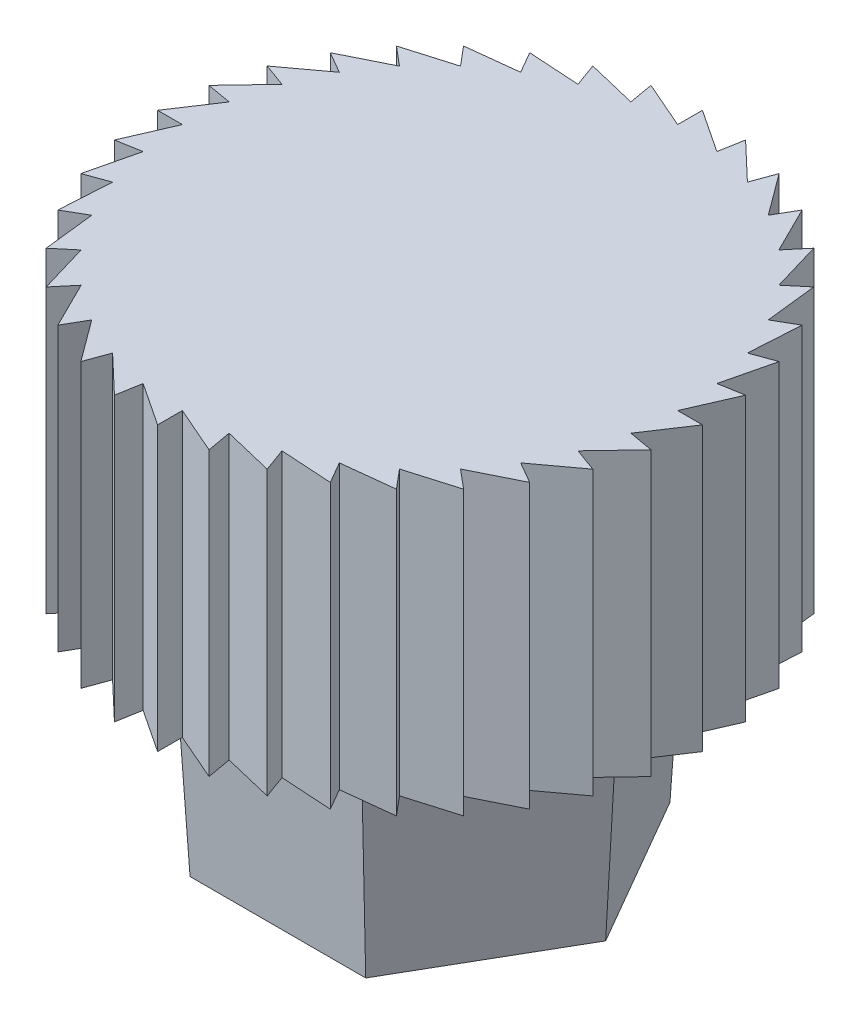
from build123d import *

# Parameters (mm, degrees)
BOSS_EXTRUDE1_DEPTH = 4


with BuildPart() as part:
    # Sketch1 → Loft1 section 0
    with BuildSketch(Plane(origin=(0, 0, 0), x_dir=(1, 0, 0), z_dir=(0, 1, 0))):
        with BuildLine():
            Line((2.482606158, 0), (1.241303079, 2.15))
            Line((1.241303079, 2.15), (-1.241303079, 2.15))
            Line((-1.241303079, 2.15), (-2.482606158, 0))
            Line((-2.482606158, 0), (-1.241303079, -2.15))
            Line((-1.241303079, -2.15), (1.241303079, -2.15))
            Line((1.241303079, -2.15), (2.482606158, 0))
        make_face()
    # Sketch2 → Loft1 section 1
    with BuildSketch(Plane(origin=(0, 3, 0), x_dir=(1, 0, 0), z_dir=(0, 1, 0))):
        with BuildLine():
            Line((2.655811238, 0), (1.327905619, 2.3))
            Line((1.327905619, 2.3), (-1.327905619, 2.3))
            Line((-1.327905619, 2.3), (-2.655811238, 0))
            Line((-2.655811238, 0), (-1.327905619, -2.3))
            Line((-1.327905619, -2.3), (1.327905619, -2.3))
            Line((1.327905619, -2.3), (2.655811238, 0))
        make_face()
    loft()

    # Sketch3 → Boss-Extrude1 (add)
    with BuildSketch(Plane(origin=(0, 3, 0), x_dir=(1, 0, 0), z_dir=(0, 1, 0))):
        Polygon((0, 3.5), (0, 3.85), (0.607768622, 3.446827136), (0.668545484, 3.791509849), (1.197070502, 3.288924173), (1.316777552, 3.61781659), (1.75, 3.031088913), (1.925, 3.334197805), (2.249756634, 2.681155551), (2.474732297, 2.949271106), (2.681155551, 2.249756634), (2.949271106, 2.474732297), (3.031088913, 1.75), (3.334197805, 1.925), (3.288924173, 1.197070502), (3.61781659, 1.316777552), (3.446827136, 0.607768622), (3.791509849, 0.668545484), (3.5, 0), (3.85, 0), (3.446827136, -0.607768622), (3.791509849, -0.668545484), (3.288924173, -1.197070502), (3.61781659, -1.316777552), (3.031088913, -1.75), (3.334197805, -1.925), (2.681155551, -2.249756634), (2.949271106, -2.474732297), (2.249756634, -2.681155551), (2.474732297, -2.949271106), (1.75, -3.031088913), (1.925, -3.334197805), (1.197070502, -3.288924173), (1.316777552, -3.61781659), (0.607768622, -3.446827136), (0.668545484, -3.791509849), (0, -3.5), (0, -3.85), (-0.607768622, -3.446827136), (-0.668545484, -3.791509849), (-1.197070502, -3.288924173), (-1.316777552, -3.61781659), (-1.75, -3.031088913), (-1.925, -3.334197805), (-2.249756634, -2.681155551), (-2.474732297, -2.949271106), (-2.681155551, -2.249756634), (-2.949271106, -2.474732297), (-3.031088913, -1.75), (-3.334197805, -1.925), (-3.288924173, -1.197070502), (-3.61781659, -1.316777552), (-3.446827136, -0.607768622), (-3.791509849, -0.668545484), (-3.5, 0), (-3.85, 0), (-3.446827136, 0.607768622), (-3.791509849, 0.668545484), (-3.288924173, 1.197070502), (-3.61781659, 1.316777552), (-3.031088913, 1.75), (-3.334197805, 1.925), (-2.681155551, 2.249756634), (-2.949271106, 2.474732297), (-2.249756634, 2.681155551), (-2.474732297, 2.949271106), (-1.75, 3.031088913), (-1.925, 3.334197805), (-1.197070502, 3.288924173), (-1.316777552, 3.61781659), (-0.607768622, 3.446827136), (-0.668545484, 3.791509849), align=None)
    extrude(amount=BOSS_EXTRUDE1_DEPTH)


solid = part.part
